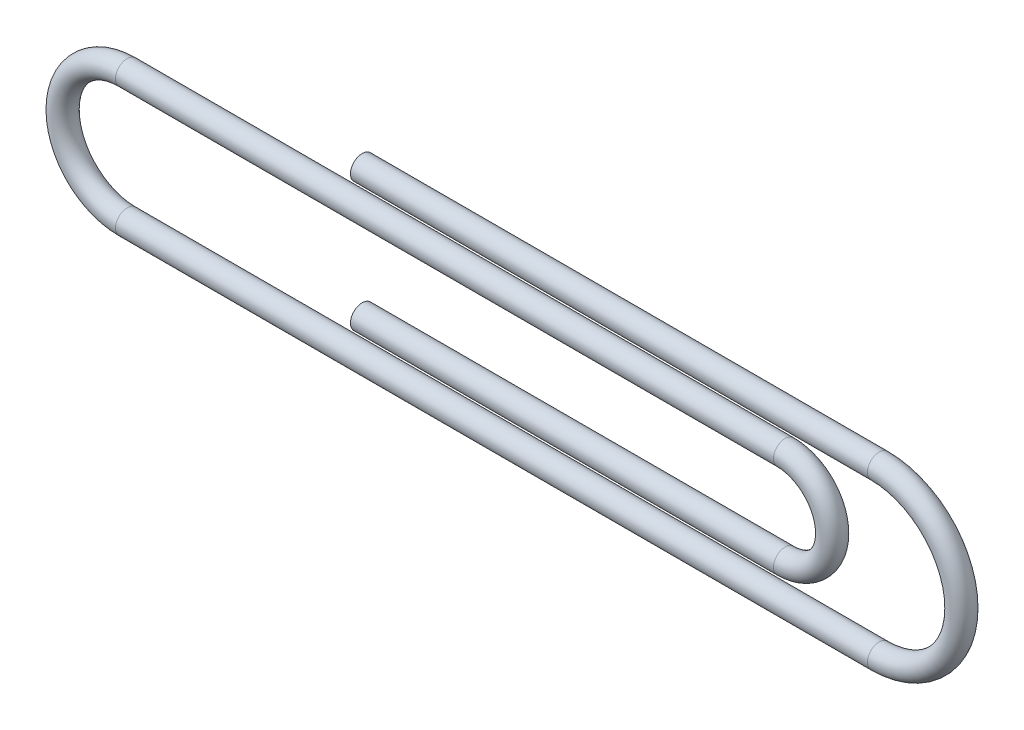
from build123d import *

# Parameters (mm, degrees)
SWEEP1_PROFILE_R = 0.5


with BuildPart() as part:
    # Sweep1: sweep along a path in Sketch1
    with BuildLine(Plane.XY) as sweep1_path:
        Line((-7.024590164, 0), (14.975409836, 0))
        ThreePointArc((14.975409836, 0), (18.475409836, -3.5), (14.975409836, -7))
        Line((14.975409836, -7), (-17.024590164, -7))
        ThreePointArc((-17.024590164, -7), (-19.774590164, -4.25), (-17.024590164, -1.5))
        Line((-17.024590164, -1.5), (10.975409836, -1.5))
        ThreePointArc((10.975409836, -1.5), (12.975409836, -3.5), (10.975409836, -5.5))
        Line((10.975409836, -5.5), (-7.024590164, -5.5))
    # Sweep1 profile (on start of the path) → Sweep1 (sweep)
    with BuildSketch(Plane.YZ.offset(-7.024590164)):
        Circle(SWEEP1_PROFILE_R)
    sweep(path=sweep1_path.line)


solid = part.part
